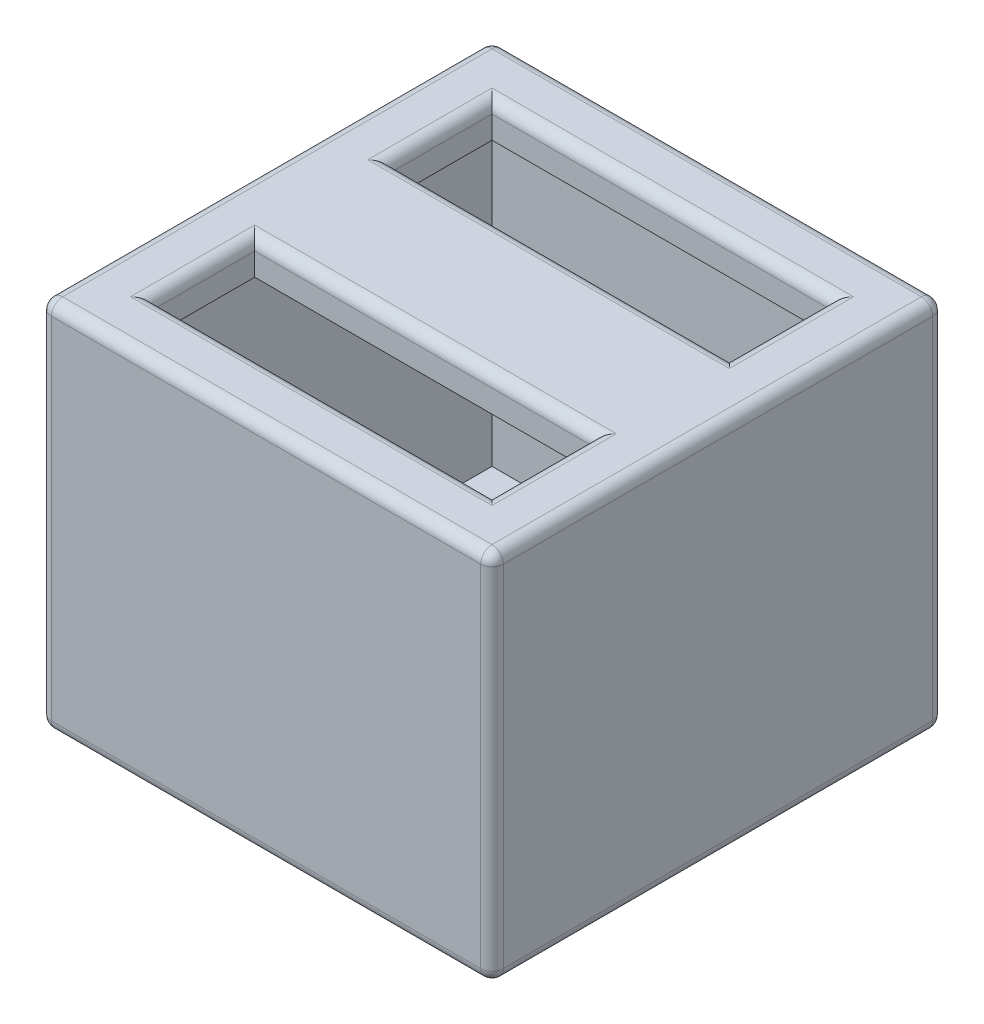
from build123d import *

# Parameters (mm, degrees)
SKETCH1_W           = 40
SKETCH1_H           = 40
BOSS_EXTRUDE1_DEPTH = 30
SHELL1_T            = -3
SKETCH2_W           = 40
SKETCH2_H           = 40
BOSS_EXTRUDE2_DEPTH = 3
SKETCH3_W           = 30
SKETCH3_H           = 9
CUT_EXTRUDE1_DEPTH  = 3
FILLET1_R           = 1


with BuildPart() as part:
    # Sketch1 → Boss-Extrude1 (new body)
    with BuildSketch(Plane(origin=(0, 0, 0), x_dir=(1, 0, 0), z_dir=(0, 1, 0))):
        Rectangle(SKETCH1_W, SKETCH1_H)
    extrude(amount=BOSS_EXTRUDE1_DEPTH)

    # Shell1
    shell1_openings = [part.faces().sort_by_distance(p)[0] for p in [
        (0, 30, 0),
    ]]
    offset(amount=SHELL1_T, openings=shell1_openings, kind=Kind.INTERSECTION)

    # Sketch2 → Boss-Extrude2 (add)
    with BuildSketch(Plane(origin=(0, 30, 0), x_dir=(1, 0, 0), z_dir=(0, 1, 0))):
        Rectangle(SKETCH2_W, SKETCH2_H)
    extrude(amount=BOSS_EXTRUDE2_DEPTH)

    # Sketch3 → Cut-Extrude1 (cut)
    with BuildSketch(Plane(origin=(0, 33, 0), x_dir=(1, 0, 0), z_dir=(0, 1, 0))):
        with Locations((0, -10.5)):
            Rectangle(SKETCH3_W, SKETCH3_H)
        with Locations((0, 10.5)):
            Rectangle(SKETCH3_W, SKETCH3_H)
    extrude(amount=-CUT_EXTRUDE1_DEPTH, mode=Mode.SUBTRACT)

    # Fillet1
    fillet1_edges = [part.edges().sort_by_distance(p)[0] for p in [
        (0, 33, -20),
        (20, 33, 0),
        (0, 33, 20),
        (-20, 33, 0),
        (15, 33, -10.5),
        (0, 33, -15),
        (-15, 33, -10.5),
        (0, 33, -6),
        (15, 33, 10.5),
        (0, 33, 6),
        (-15, 33, 10.5),
        (0, 33, 15),
        (-20, 0, 0),
        (-20, 16.5, -20),
        (0, 0, -20),
        (20, 16.5, -20),
        (20, 0, 0),
        (-20, 16.5, 20),
        (20, 16.5, 20),
        (0, 0, 20),
    ]]
    fillet(fillet1_edges, radius=FILLET1_R)


solid = part.part
